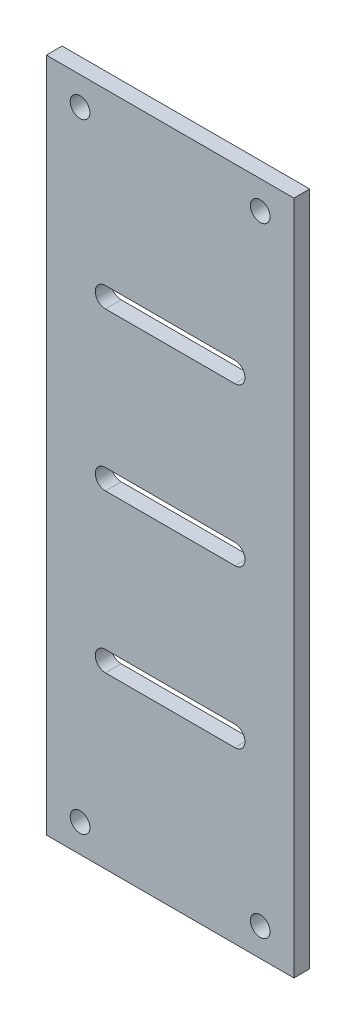
from build123d import *

# Parameters (mm, degrees)
PACK_ACCESS_WITH_STRAP_VENTILATION_PROFI_W = 44
PACK_ACCESS_WITH_STRAP_VENTILATION_PROFI_H = 120
PACK_ACCESS_WITH_STRAP_VENTILATION_PROFI_R = 1.75
PACK_ACCESS_WITH_STRAP_VENTILATION_DEPTH   = 2.8


with BuildPart() as part:
    # Pack access with strap ventilation profile → Pack access with strap ventilation (new body)
    with BuildSketch(Plane.XY):
        Rectangle(PACK_ACCESS_WITH_STRAP_VENTILATION_PROFI_W, PACK_ACCESS_WITH_STRAP_VENTILATION_PROFI_H)
        with Locations((-16, -55)):
            Circle(PACK_ACCESS_WITH_STRAP_VENTILATION_PROFI_R, mode=Mode.SUBTRACT)
        with Locations((-16, 55)):
            Circle(PACK_ACCESS_WITH_STRAP_VENTILATION_PROFI_R, mode=Mode.SUBTRACT)
        with Locations((16, -55)):
            Circle(PACK_ACCESS_WITH_STRAP_VENTILATION_PROFI_R, mode=Mode.SUBTRACT)
        with Locations((16, 55)):
            Circle(PACK_ACCESS_WITH_STRAP_VENTILATION_PROFI_R, mode=Mode.SUBTRACT)
        with BuildLine():
            Line((-11.5, -29.8), (11.5, -29.8))
            ThreePointArc((11.5, -29.8), (13.3, -28), (11.5, -26.2))
            Line((11.5, -26.2), (-11.5, -26.2))
            ThreePointArc((-11.5, -26.2), (-13.3, -28), (-11.5, -29.8))
        make_face(mode=Mode.SUBTRACT)
        with BuildLine():
            Line((-11.5, -1.8), (11.5, -1.8))
            ThreePointArc((11.5, -1.8), (13.3, 0), (11.5, 1.8))
            Line((11.5, 1.8), (-11.5, 1.8))
            ThreePointArc((-11.5, 1.8), (-13.3, 0), (-11.5, -1.8))
        make_face(mode=Mode.SUBTRACT)
        with BuildLine():
            Line((-11.5, 26.2), (11.5, 26.2))
            ThreePointArc((11.5, 26.2), (13.3, 28), (11.5, 29.8))
            Line((11.5, 29.8), (-11.5, 29.8))
            ThreePointArc((-11.5, 29.8), (-13.3, 28), (-11.5, 26.2))
        make_face(mode=Mode.SUBTRACT)
    extrude(amount=PACK_ACCESS_WITH_STRAP_VENTILATION_DEPTH)


solid = part.part
